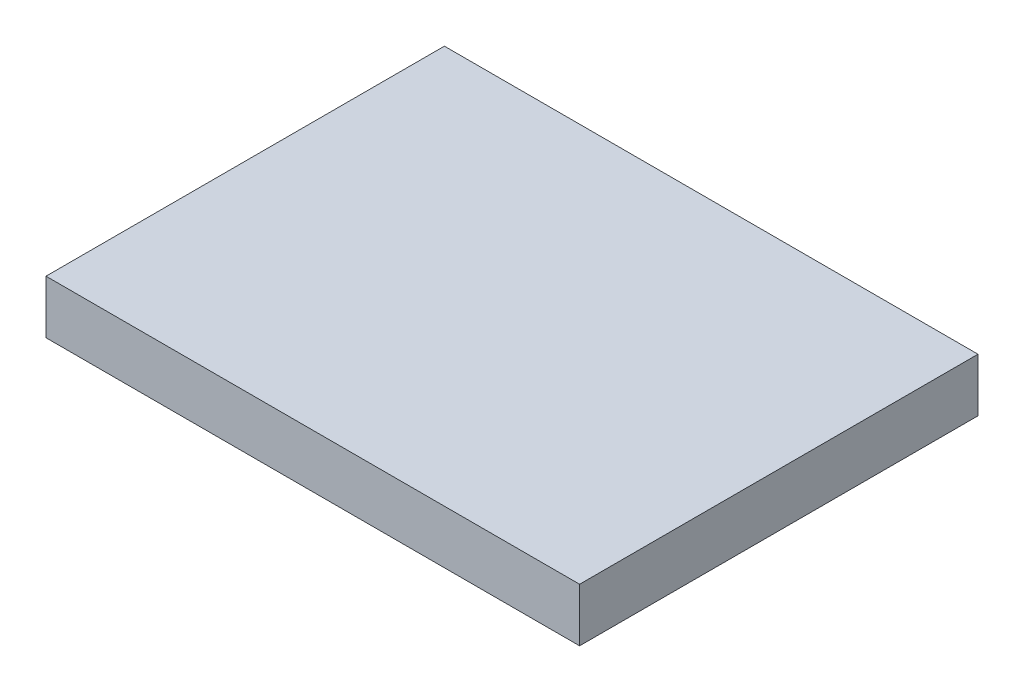
from build123d import *

# Parameters (mm, degrees)
SKETCH1_W           = 1905
SKETCH1_H           = 1422.4
BOSS_EXTRUDE1_DEPTH = 190.5


with BuildPart() as part:
    # Sketch1 → Boss-Extrude1 (new body)
    with BuildSketch(Plane(origin=(0, 0, 0), x_dir=(1, 0, 0), z_dir=(0, 1, 0))):
        Rectangle(SKETCH1_W, SKETCH1_H)
    extrude(amount=BOSS_EXTRUDE1_DEPTH)


solid = part.part
